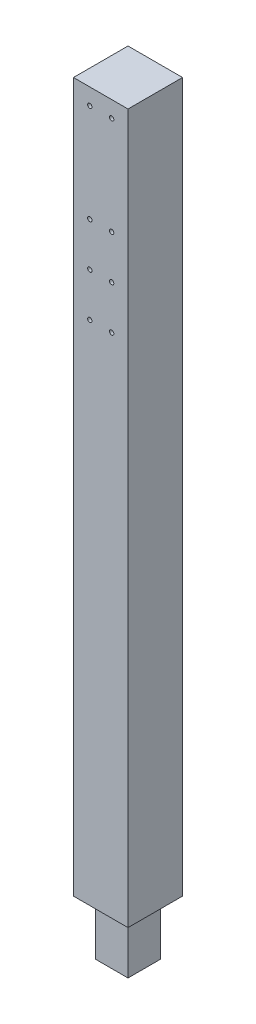
from build123d import *

# Parameters (mm, degrees)
SKETCH2_W               = 25
SKETCH2_H               = 25
BOSS_EXTRUDE1_DEPTH     = 350
SKETCH3_R               = 1
CUT_EXTRUDE1_DEPTH      = 352.781181987
CUT_EXTRUDE2_DEPTH      = 352.781181987
CUT_EXTRUDE2_DEPTH_BACK = 352.781181987
SKETCH4_W               = 5
SKETCH4_H               = 25
SKETCH5_W               = 5
SKETCH5_H               = 25
CUT_EXTRUDE3_DEPTH      = 352.461235416


with BuildPart() as part:
    # Sketch2 → Boss-Extrude1 (new body)
    with BuildSketch(Plane(origin=(0, 0, 0), x_dir=(1, 0, 0), z_dir=(0, 1, 0))):
        with Locations((12.5, 12.5)):
            Rectangle(SKETCH2_W, SKETCH2_H)
    extrude(amount=BOSS_EXTRUDE1_DEPTH)

    # Sketch3 → Cut-Extrude1 (cut, through all)
    with BuildSketch(Plane.XY):
        with Locations((7.5, 342.5)):
            Circle(SKETCH3_R)
        with Locations((7.5, 297.5)):
            Circle(SKETCH3_R)
        with Locations((7.5, 277.5)):
            Circle(SKETCH3_R)
        with Locations((7.5, 257.5)):
            Circle(SKETCH3_R)
        with Locations(Location((17.5, 342.5, 0), (0, 0, 180))):
            Circle(SKETCH3_R)
        with Locations(Location((17.5, 297.5, 0), (0, 0, 180))):
            Circle(SKETCH3_R)
        with Locations(Location((17.5, 277.5, 0), (0, 0, 180))):
            Circle(SKETCH3_R)
        with Locations(Location((17.5, 257.5, 0), (0, 0, 180))):
            Circle(SKETCH3_R)
    extrude(amount=-CUT_EXTRUDE1_DEPTH, mode=Mode.SUBTRACT)

    # Sketch4 → Cut-Extrude2 (cut, two sides: drawn at the far end of the back side and taken through both)
    with BuildSketch(Plane.ZY.offset(-CUT_EXTRUDE2_DEPTH_BACK)):
        with Locations((-22.5, 12.5)):
            Rectangle(SKETCH4_W, SKETCH4_H)
        with Locations((-2.5, 12.5)):
            Rectangle(SKETCH4_W, SKETCH4_H)
    extrude(amount=CUT_EXTRUDE2_DEPTH + CUT_EXTRUDE2_DEPTH_BACK, mode=Mode.SUBTRACT)

    # Sketch5 → Cut-Extrude3 (cut, through all)
    with BuildSketch(Plane(origin=(0, 0, -20), x_dir=(-1, 0, 0), z_dir=(0, 0, -1))):
        with Locations((-22.5, 12.5)):
            Rectangle(SKETCH5_W, SKETCH5_H)
        with Locations((-2.5, 12.5)):
            Rectangle(SKETCH5_W, SKETCH5_H)
    extrude(amount=-CUT_EXTRUDE3_DEPTH, mode=Mode.SUBTRACT)


solid = part.part
